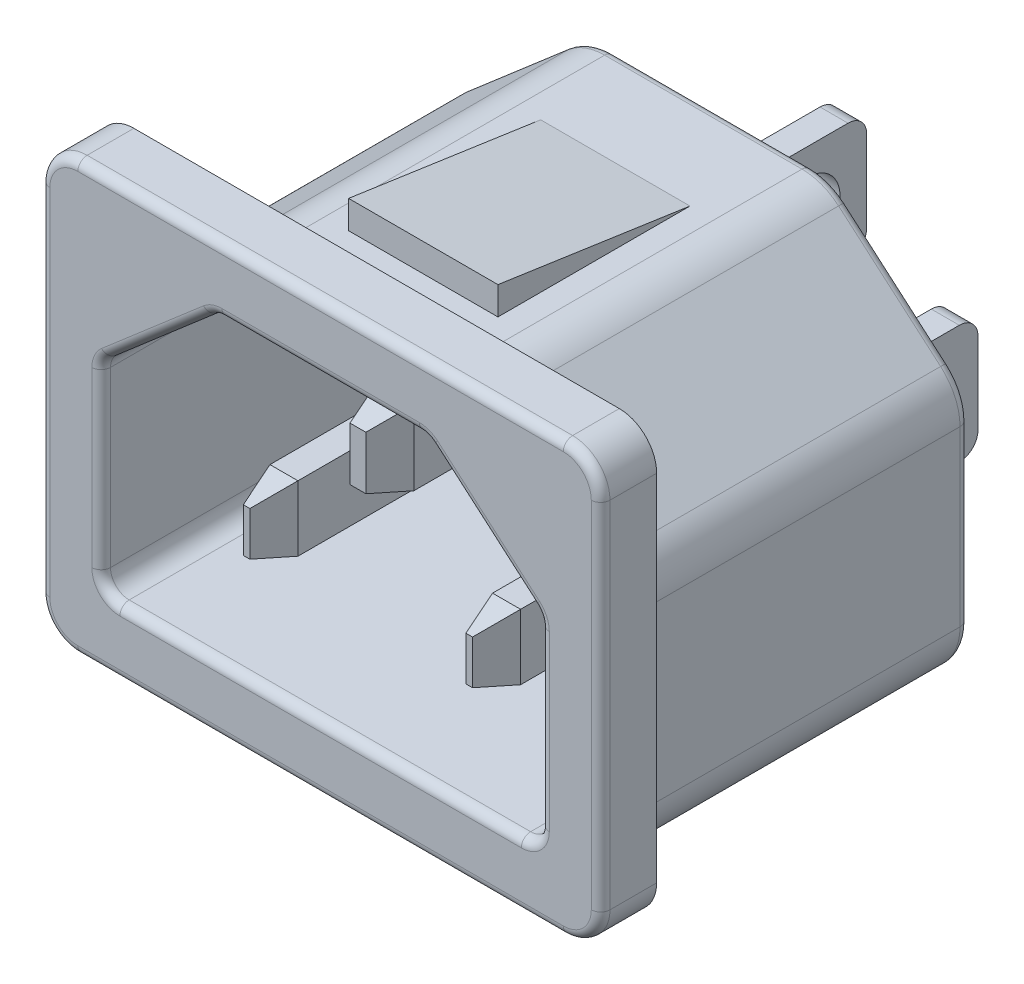
from build123d import *

# Parameters (mm, degrees)
BOSS_EXTRUDE1_DEPTH           = 3
BOSS_EXTRUDE2_DEPTH           = 18
CUT_EXTRUDE1_DEPTH            = 18
FILLET2_R                     = 0.5
BOSS_EXTRUDE3_DEPTH           = 4
BOSS_EXTRUDE4_START           = 3
BOSS_EXTRUDE4_DEPTH           = 5
SKETCH6_W                     = 2
SKETCH6_H                     = 4
SKETCH6_W_2                   = 1.5
SKETCH6_H_2                   = 3.5
BOSS_EXTRUDE5_DEPTH           = 14
SKETCH7_W                     = 1.5
SKETCH7_H                     = 3.5
BOSS_EXTRUDE6_DEPTH           = 2
BOSS_EXTRUDE6_DRAFT           = 16
SKETCH7_W_2                   = 2
SKETCH7_H_2                   = 4
BOSS_EXTRUDE6_PROFILE_2_DEPTH = 2
BOSS_EXTRUDE6_PROFILE_2_DRAFT = 16
BOSS_EXTRUDE6_PROFILE_3_DEPTH = 2
BOSS_EXTRUDE6_PROFILE_3_DRAFT = 16
SKETCH8_W                     = 1.5
SKETCH8_H                     = 6.35
BOSS_EXTRUDE7_DEPTH           = 7.5
FILLET3_R                     = 1
SKETCH9_R                     = 1.75
CUT_EXTRUDE2_DEPTH            = 11


with BuildPart() as part:
    # Sketch1 → Boss-Extrude1 (new body)
    with BuildSketch(Plane.XY):
        with BuildLine():
            Line((-13, -11.5), (13, -11.5))
            ThreePointArc((13, -11.5), (14.414213562, -10.914213562), (15, -9.5))
            Line((15, -9.5), (15, 9.5))
            ThreePointArc((15, 9.5), (14.414213562, 10.914213562), (13, 11.5))
            Line((13, 11.5), (-13, 11.5))
            ThreePointArc((-13, 11.5), (-14.414213562, 10.914213562), (-15, 9.5))
            Line((-15, 9.5), (-15, -9.5))
            ThreePointArc((-15, -9.5), (-14.414213562, -10.914213562), (-13, -11.5))
        make_face()
    extrude(amount=BOSS_EXTRUDE1_DEPTH)

    # Sketch2 → Boss-Extrude2 (add)
    with BuildSketch(Plane(origin=(0, 0, 0), x_dir=(-1, 0, 0), z_dir=(0, 0, -1))):
        with BuildLine():
            Line((-7.244277484, 9.271690642), (-12.709444213, 4.557717215))
            ThreePointArc((-12.709444213, 4.557717215), (-13.477483514, 3.535359867), (-13.75, 2.286026573))
            Line((-13.75, 2.286026573), (-13.75, -7))
            ThreePointArc((-13.75, -7), (-12.871320344, -9.121320344), (-10.75, -10))
            Line((-10.75, -10), (10.75, -10))
            ThreePointArc((10.75, -10), (12.871320344, -9.121320344), (13.75, -7))
            Line((13.75, -7), (13.75, 2.286026573))
            ThreePointArc((13.75, 2.286026573), (13.477483514, 3.535359867), (12.709444213, 4.557717215))
            Line((12.709444213, 4.557717215), (7.244277484, 9.271690642))
            ThreePointArc((7.244277484, 9.271690642), (6.330043315, 9.812034133), (5.28483327, 10))
            Line((5.28483327, 10), (-5.28483327, 10))
            ThreePointArc((-5.28483327, 10), (-6.330043315, 9.812034133), (-7.244277484, 9.271690642))
        make_face()
    extrude(amount=BOSS_EXTRUDE2_DEPTH)

    # Sketch3 → Cut-Extrude1 (cut)
    with BuildSketch(Plane.XY.offset(3)):
        with BuildLine():
            Line((11.403148071, 3.043256787), (5.937981342, 7.757230214))
            ThreePointArc((5.937981342, 7.757230214), (5.633236618, 7.937344711), (5.28483327, 8))
            Line((5.28483327, 8), (-5.28483327, 8))
            ThreePointArc((-5.28483327, 8), (-5.633236618, 7.937344711), (-5.937981342, 7.757230214))
            Line((-5.937981342, 7.757230214), (-11.403148071, 3.043256787))
            ThreePointArc((-11.403148071, 3.043256787), (-11.659161171, 2.702471004), (-11.75, 2.286026573))
            Line((-11.75, 2.286026573), (-11.75, -7))
            ThreePointArc((-11.75, -7), (-11.457106781, -7.707106781), (-10.75, -8))
            Line((-10.75, -8), (10.75, -8))
            ThreePointArc((10.75, -8), (11.457106781, -7.707106781), (11.75, -7))
            Line((11.75, -7), (11.75, 2.286026573))
            ThreePointArc((11.75, 2.286026573), (11.659161171, 2.702471004), (11.403148071, 3.043256787))
        make_face()
    extrude(amount=-CUT_EXTRUDE1_DEPTH, mode=Mode.SUBTRACT)

    # Fillet2
    fillet2_edges = [part.edges().sort_by_distance(p)[0] for p in [
        (14.414213562, -10.914213562, 3),
        (15, 0, 3),
        (14.414213562, 10.914213562, 3),
        (0, 11.5, 3),
        (-14.414213562, 10.914213562, 3),
        (-15, 0, 3),
        (9.976860849, 6.914703929, -18),
        (13.75, -2.356986713, -18),
        (12.871320344, -9.121320344, -18),
        (-13.477483514, 3.535359867, -18),
        (-9.976860849, 6.914703929, -18),
        (-6.330043315, 9.812034133, -18),
        (0, 10, -18),
        (6.330043315, 9.812034133, -18),
        (13.477483514, 3.535359867, -18),
        (0, -10, -18),
        (-12.871320344, -9.121320344, -18),
        (-13.75, -2.356986713, -18),
        (-14.414213562, -10.914213562, 3),
        (11.659161171, 2.702471004, 3),
        (8.670564706, 5.400243501, 3),
        (5.633236618, 7.937344711, 3),
        (0, 8, 3),
        (-5.633236618, 7.937344711, 3),
        (-8.670564706, 5.400243501, 3),
        (-11.659161171, 2.702471004, 3),
        (-11.75, -2.356986713, 3),
        (-11.457106781, -7.707106781, 3),
        (0, -8, 3),
        (11.457106781, -7.707106781, 3),
        (11.75, -2.356986713, 3),
        (0, -11.5, 3),
    ]]
    fillet(fillet2_edges, radius=FILLET2_R)

    # Sketch4 → Boss-Extrude3 (add, symmetric)
    with BuildSketch(Plane(origin=(0, 0, 0), x_dir=(0, 0, -1), z_dir=(1, 0, 0))):
        Polygon((2.5, 10), (2.5, 11.5), (12.788235775, 10), align=None)
    extrude(amount=BOSS_EXTRUDE3_DEPTH, both=True)

    # Sketch5 → Boss-Extrude4 (add)
    with BuildSketch(Plane(origin=(0, 0, 0), x_dir=(0, 0, -1), z_dir=(1, 0, 0)).offset(BOSS_EXTRUDE4_START)):
        Polygon((2.5, -10), (12.788235775, -10), (2.5, -11.5), align=None)
    boss_extrude4 = extrude(amount=BOSS_EXTRUDE4_DEPTH)

    # Mirror1: Boss-Extrude4 across plane
    add(boss_extrude4.mirror(Plane(origin=(0, 0, 0), x_dir=(0, 0, 1), z_dir=(1, 0, 0))))

    # Sketch6 → Boss-Extrude5 (add)
    with BuildSketch(Plane.XY.offset(-15)):
        with Locations((0, 3.188606821)):
            Rectangle(SKETCH6_W, SKETCH6_H)
        with Locations((-5.961546064, -3.204394816)):
            Rectangle(SKETCH6_W_2, SKETCH6_H_2)
        with Locations((5.961546064, -3.204394816)):
            Rectangle(SKETCH6_W_2, SKETCH6_H_2)
    extrude(amount=BOSS_EXTRUDE5_DEPTH)


with BuildPart() as boss_extrude6_tool:
    # Sketch7 → Boss-Extrude6 (with draft: the straight prism first)
    with BuildSketch(Plane.XY.offset(-1)):
        with Locations((-5.961546064, -3.204394816)):
            Rectangle(SKETCH7_W, SKETCH7_H)
    extrude(amount=BOSS_EXTRUDE6_DEPTH)
    # Boss-Extrude6: the draft: its side faces are tilted about the plane it starts from
    boss_extrude6_sides = [boss_extrude6_tool.faces().sort_by_distance(p)[0] for p in [
        (-5.211546064, -3.204394816, 0),
        (-5.961546064, -1.454394816, 0),
        (-6.711546064, -3.204394816, 0),
        (-5.961546064, -4.954394816, 0),
    ]]
    draft(boss_extrude6_sides, Plane.XY.offset(-1), BOSS_EXTRUDE6_DRAFT)


with BuildPart() as part_1:
    add(part.part)

    # Boss-Extrude6: add boss_extrude6_tool
    add(boss_extrude6_tool.part)


with BuildPart() as boss_extrude6_profile_2_tool:
    # Sketch7 → Boss-Extrude6 profile 2 (with draft: the straight prism first)
    with BuildSketch(Plane.XY.offset(-1)):
        with Locations((0, 3.188606821)):
            Rectangle(SKETCH7_W_2, SKETCH7_H_2)
    extrude(amount=BOSS_EXTRUDE6_PROFILE_2_DEPTH)
    # Boss-Extrude6 profile 2: the draft: its side faces are tilted about the plane it starts from
    boss_extrude6_profile_2_sides = [boss_extrude6_profile_2_tool.faces().sort_by_distance(p)[0] for p in [
        (-1, 3.188606821, 0),
        (0, 1.188606821, 0),
        (1, 3.188606821, 0),
        (0, 5.188606821, 0),
    ]]
    draft(boss_extrude6_profile_2_sides, Plane.XY.offset(-1), BOSS_EXTRUDE6_PROFILE_2_DRAFT)


with BuildPart() as part_2:
    add(part_1.part)

    # Boss-Extrude6 profile 2: add boss_extrude6_profile_2_tool
    add(boss_extrude6_profile_2_tool.part)


with BuildPart() as boss_extrude6_profile_3_tool:
    # Sketch7 → Boss-Extrude6 profile 3 (with draft: the straight prism first)
    with BuildSketch(Plane.XY.offset(-1)):
        with Locations((5.961546064, -3.204394816)):
            Rectangle(SKETCH7_W, SKETCH7_H)
    extrude(amount=BOSS_EXTRUDE6_PROFILE_3_DEPTH)
    # Boss-Extrude6 profile 3: the draft: its side faces are tilted about the plane it starts from
    boss_extrude6_profile_3_sides = [boss_extrude6_profile_3_tool.faces().sort_by_distance(p)[0] for p in [
        (6.711546064, -3.204394816, 0),
        (5.961546064, -1.454394816, 0),
        (5.211546064, -3.204394816, 0),
        (5.961546064, -4.954394816, 0),
    ]]
    draft(boss_extrude6_profile_3_sides, Plane.XY.offset(-1), BOSS_EXTRUDE6_PROFILE_3_DRAFT)


with BuildPart() as part_3:
    add(part_2.part)

    # Boss-Extrude6 profile 3: add boss_extrude6_profile_3_tool
    add(boss_extrude6_profile_3_tool.part)

    # Sketch8 → Boss-Extrude7 (add)
    with BuildSketch(Plane(origin=(0, 0, -18), x_dir=(-1, 0, 0), z_dir=(0, 0, -1))):
        with Locations((0, 3.188606821)):
            Rectangle(SKETCH8_W, SKETCH8_H)
        with Locations((-5.961546064, -3.204394816)):
            Rectangle(SKETCH8_W, SKETCH8_H)
        with Locations((5.961546064, -3.204394816)):
            Rectangle(SKETCH8_W, SKETCH8_H)
    extrude(amount=BOSS_EXTRUDE7_DEPTH)

    # Fillet3
    fillet3_edges = [part_3.edges().sort_by_distance(p)[0] for p in [
        (0, 0.013606821, -25.5),
        (0, 6.363606821, -25.5),
        (5.961546064, -6.379394816, -25.5),
        (5.961546064, -0.029394816, -25.5),
        (-5.961546064, -6.379394816, -25.5),
        (-5.961546064, -0.029394816, -25.5),
    ]]
    fillet(fillet3_edges, radius=FILLET3_R)

    # Sketch9 → Cut-Extrude2 (cut, symmetric)
    with BuildSketch(Plane(origin=(0.75, 0, 0), x_dir=(0, 0, -1), z_dir=(1, 0, 0))):
        with Locations(Location((22.325, 3.188606821, 0), (0, 0, 90))):
            Circle(SKETCH9_R)
        with Locations(Location((22.325, -3.204394816, 0), (0, 0, 90))):
            Circle(SKETCH9_R)
    extrude(amount=CUT_EXTRUDE2_DEPTH, both=True, mode=Mode.SUBTRACT)


solid = part_3.part
